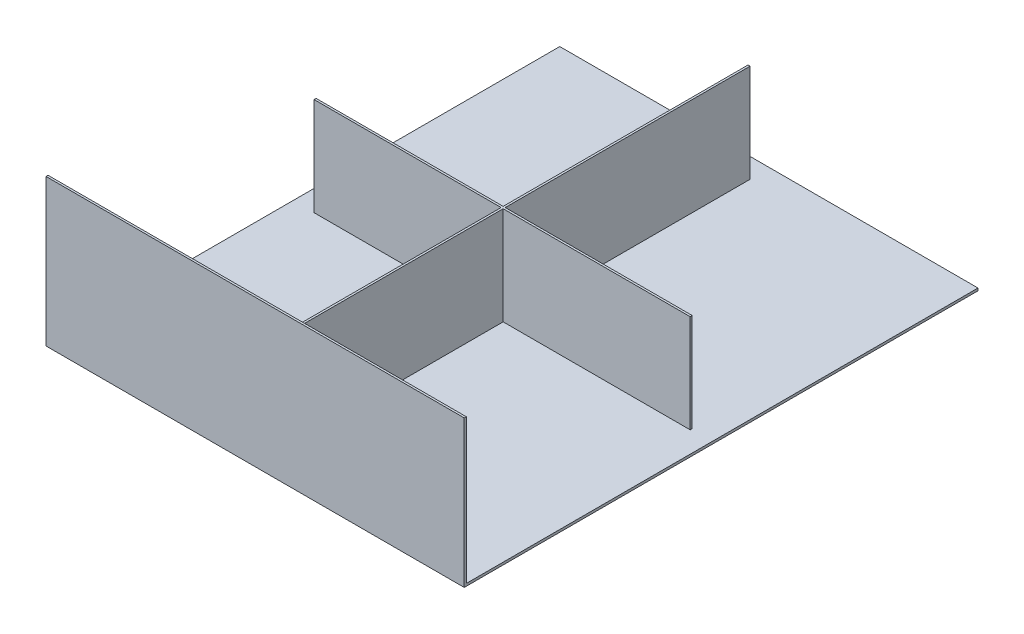
from build123d import *

# Parameters (mm, degrees)
BOSS_EXTRUDE1_DEPTH = 2.64
SKETCH2_W           = 450.7
SKETCH2_H           = 2.2
BOSS_EXTRUDE2_DEPTH = 155.6
BOSS_EXTRUDE3_DEPTH = 105.6


with BuildPart() as part:
    # Sketch1 → Boss-Extrude1 (new body)
    with BuildSketch(Plane(origin=(0, 0, 0), x_dir=(1, 0, 0), z_dir=(0, 1, 0))):
        Polygon((-225.35, 287.45), (-225.35, -266.2), (-204.1, -266.2), (204.1, -266.2), (225.35, -266.2), (225.35, 287.45), align=None)
    extrude(amount=BOSS_EXTRUDE1_DEPTH)

    # Sketch2 → Boss-Extrude2 (add)
    with BuildSketch(Plane(origin=(0, 2.64, 0), x_dir=(1, 0, 0), z_dir=(0, 1, 0))):
        with Locations((0, -265.1)):
            Rectangle(SKETCH2_W, SKETCH2_H)
    extrude(amount=BOSS_EXTRUDE2_DEPTH)

    # Sketch3 → Boss-Extrude3 (add)
    with BuildSketch(Plane(origin=(0, 2.64, 0), x_dir=(1, 0, 0), z_dir=(0, 1, 0))):
        Polygon((1.1, -264), (1.1, 0), (202.6, 0), (202.6, 2.2), (1.1, 2.2), (1.1, 266.2), (-1.1, 266.2), (-1.1, 2.2), (-202.6, 2.2), (-202.6, 0), (-1.1, 0), (-1.1, -264), align=None)
    extrude(amount=BOSS_EXTRUDE3_DEPTH)


solid = part.part
